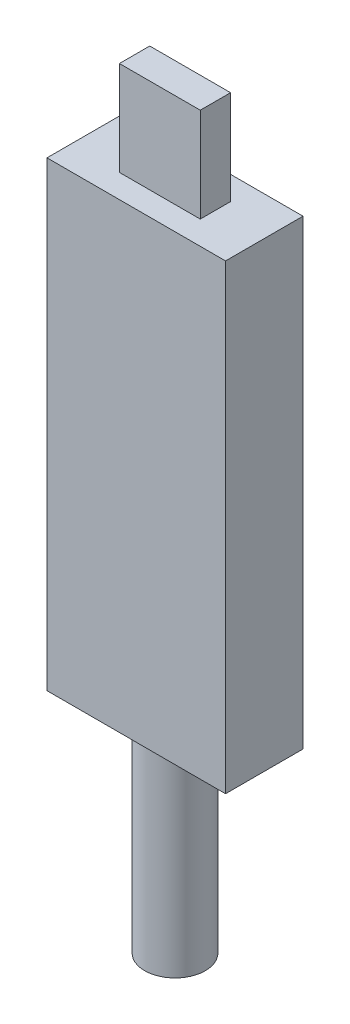
from build123d import *

# Parameters (mm, degrees)
SKETCH_1_W      = 26.5
SKETCH_1_H      = 11.5
EXTRUDE_1_DEPTH = 68.5
SKETCH_2_W      = 12
SKETCH_2_H      = 4.5
EXTRUDE_2_DEPTH = 14
SKETCH_3_R      = 4.5
EXTRUDE_3_DEPTH = 30


with BuildPart() as part:
    # 草图1 → 凸台-拉伸1 (new body)
    with BuildSketch(Plane(origin=(0, 0, 0), x_dir=(1, 0, 0), z_dir=(0, 1, 0))):
        with Locations((0.83974359, -1.993589744)):
            Rectangle(SKETCH_1_W, SKETCH_1_H)
    extrude(amount=EXTRUDE_1_DEPTH)

    # 草图2 → 凸台-拉伸2 (add)
    with BuildSketch(Plane(origin=(0, 68.5, 0), x_dir=(1, 0, 0), z_dir=(0, 1, 0))):
        with Locations((0.83974359, -1.993589744)):
            Rectangle(SKETCH_2_W, SKETCH_2_H)
    extrude(amount=EXTRUDE_2_DEPTH)

    # 草图3 → 凸台-拉伸3 (add)
    with BuildSketch(Plane.XZ):
        with Locations(Location((0.83974359, 1.993589744, 0), (0, 0, 270))):
            Circle(SKETCH_3_R)
    extrude(amount=EXTRUDE_3_DEPTH)


solid = part.part
